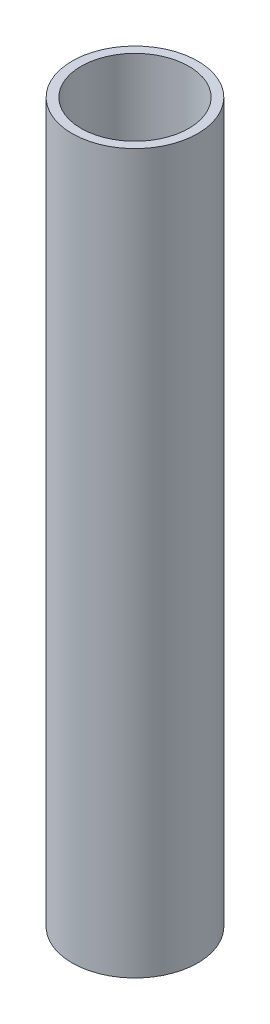
from build123d import *

# Parameters (mm, degrees)
SKETCH1_R           = 70
SKETCH1_R_2         = 60
BOSS_EXTRUDE1_DEPTH = 800


with BuildPart() as part:
    # Sketch1 → Boss-Extrude1 (new body)
    with BuildSketch(Plane(origin=(0, 0, 0), x_dir=(1, 0, 0), z_dir=(0, 1, 0))):
        with Locations(Location((0, 0, 0), (0, 0, 270))):
            Circle(SKETCH1_R)
        with Locations(Location((0, 0, 0), (0, 0, 270))):
            Circle(SKETCH1_R_2, mode=Mode.SUBTRACT)
    extrude(amount=BOSS_EXTRUDE1_DEPTH)


solid = part.part
